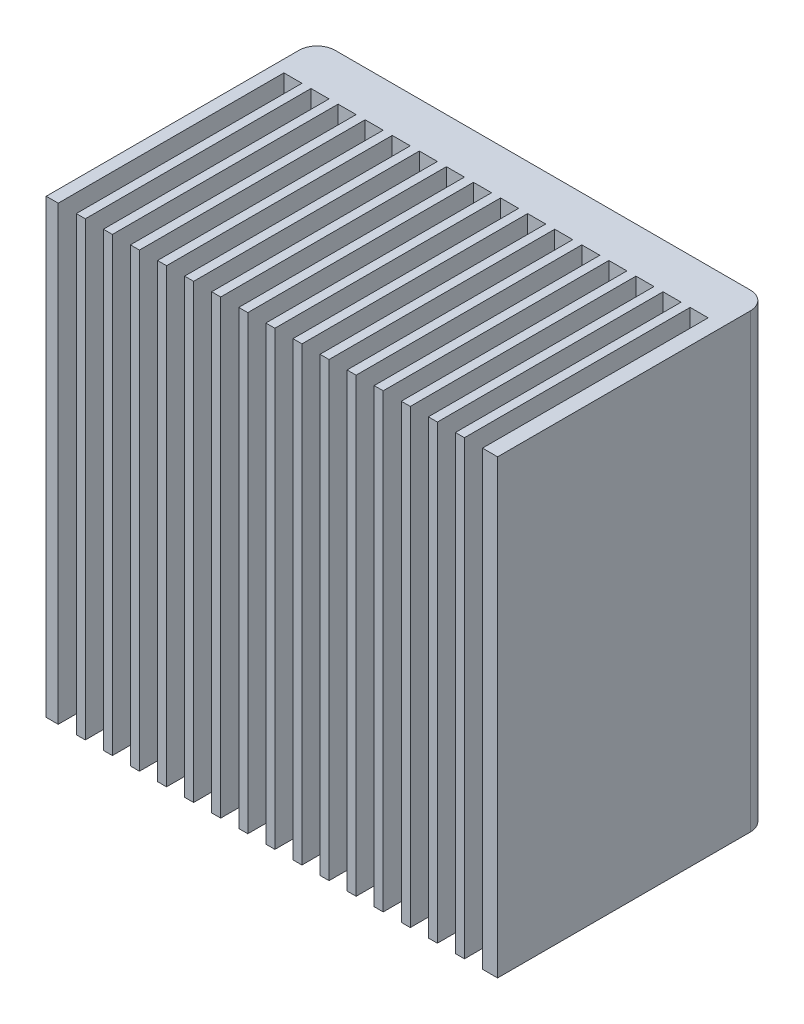
from build123d import *

# Parameters (mm, degrees)
SKETCH1_R           = 10
BOSS_EXTRUDE1_DEPTH = 1
SKETCH2_W           = 50
SKETCH2_H           = 50
BOSS_EXTRUDE2_DEPTH = 30
SKETCH3_W           = 2
SKETCH3_H           = 50
CUT_EXTRUDE1_DEPTH  = 25
FILLET1_R           = 2


with BuildPart() as part:
    # Sketch1 → Boss-Extrude1 (new body)
    with BuildSketch(Plane.XY):
        Circle(SKETCH1_R)
    extrude(amount=BOSS_EXTRUDE1_DEPTH)

    # Sketch2 → Boss-Extrude2 (add)
    with BuildSketch(Plane.XY.offset(1)):
        Rectangle(SKETCH2_W, SKETCH2_H)
    extrude(amount=BOSS_EXTRUDE2_DEPTH)

    # Sketch3 → Cut-Extrude1 (cut)
    with BuildSketch(Plane.XY.offset(31)):
        with Locations((-22.6705156, 0)):
            Rectangle(SKETCH3_W, SKETCH3_H)
        with Locations((-19.6705156, 0)):
            Rectangle(SKETCH3_W, SKETCH3_H)
        with Locations((-16.6705156, 0)):
            Rectangle(SKETCH3_W, SKETCH3_H)
        with Locations((-13.6705156, 0)):
            Rectangle(SKETCH3_W, SKETCH3_H)
        with Locations((-10.6705156, 0)):
            Rectangle(SKETCH3_W, SKETCH3_H)
        with Locations((-7.6705156, 0)):
            Rectangle(SKETCH3_W, SKETCH3_H)
        with Locations((-4.6705156, 0)):
            Rectangle(SKETCH3_W, SKETCH3_H)
        with Locations((-1.6705156, 0)):
            Rectangle(SKETCH3_W, SKETCH3_H)
        with Locations((1.3294844, 0)):
            Rectangle(SKETCH3_W, SKETCH3_H)
        with Locations((4.3294844, 0)):
            Rectangle(SKETCH3_W, SKETCH3_H)
        with Locations((7.3294844, 0)):
            Rectangle(SKETCH3_W, SKETCH3_H)
        with Locations((10.3294844, 0)):
            Rectangle(SKETCH3_W, SKETCH3_H)
        with Locations((13.3294844, 0)):
            Rectangle(SKETCH3_W, SKETCH3_H)
        with Locations((16.3294844, 0)):
            Rectangle(SKETCH3_W, SKETCH3_H)
        with Locations((19.3294844, 0)):
            Rectangle(SKETCH3_W, SKETCH3_H)
        with Locations((22.3294844, 0)):
            Rectangle(SKETCH3_W, SKETCH3_H)
    extrude(amount=-CUT_EXTRUDE1_DEPTH, mode=Mode.SUBTRACT)

    # Fillet1
    fillet1_edges = [part.edges().sort_by_distance(p)[0] for p in [
        (25, 0, 1),
        (-25, 0, 1),
    ]]
    fillet(fillet1_edges, radius=FILLET1_R)


solid = part.part
